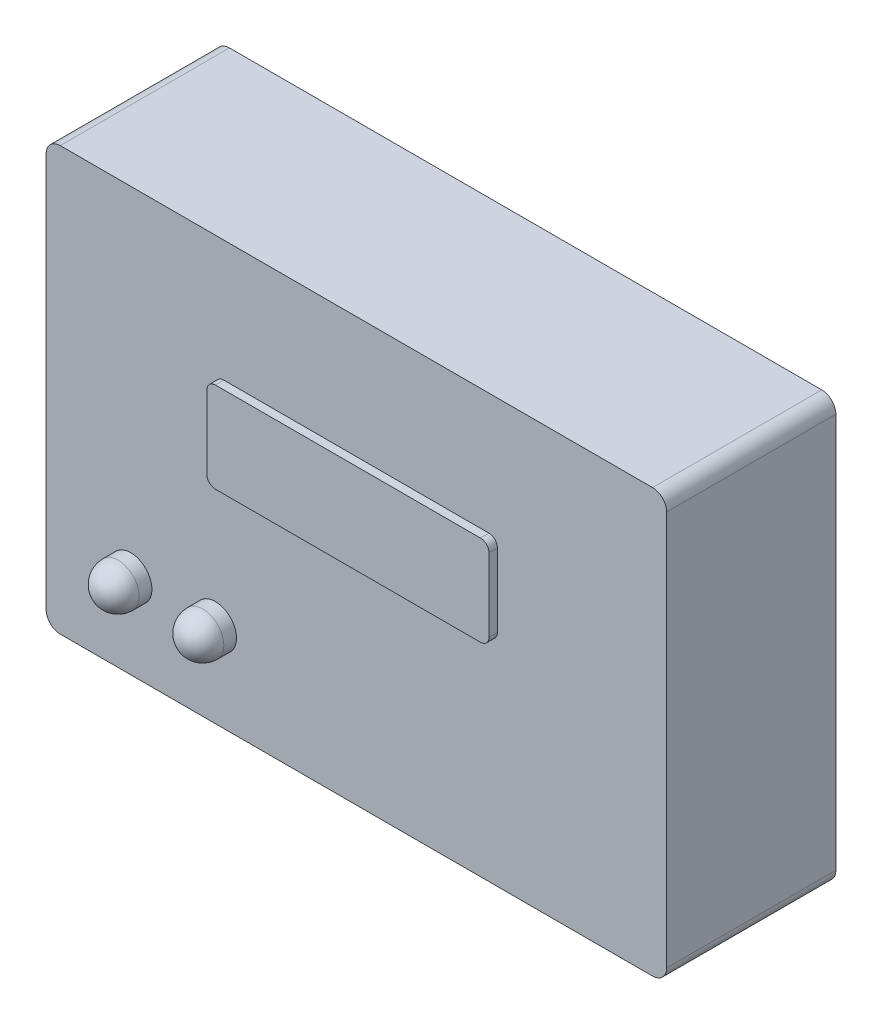
from build123d import *

# Parameters (mm, degrees)
BOSS_EXTRUDE1_DEPTH   = 30
CUT_EXTRUDE1_DEPTH    = 20
SKETCH3_R             = 2.5
BOSS_EXTRUDE2_DEPTH   = 3
SKETCH3_3_R           = 5
BOSS_EXTRUDE3_DEPTH   = 5
SKETCH3_4_R           = 7
SKETCH3_4_R_2         = 5
BOSS_EXTRUDE4_DEPTH   = 6
BOSS_EXTRUDE5_DEPTH   = 3
SKETCH5_R             = 7.5
BOSS_EXTRUDE6_DEPTH   = 12
BOSS_EXTRUDE6_2_DEPTH = 12
FILLET2_R             = 7.5
FILLET3_R             = 7.5


with BuildPart() as part:
    # Sketch1 → Boss-Extrude1 (new, symmetric)
    with BuildSketch(Plane.XY):
        with BuildLine():
            Line((-105, -75), (105, -75))
            ThreePointArc((105, -75), (108.535533906, -73.535533906), (110, -70))
            Line((110, -70), (110, 70))
            ThreePointArc((110, 70), (108.535533906, 73.535533906), (105, 75))
            Line((105, 75), (-105, 75))
            ThreePointArc((-105, 75), (-108.535533906, 73.535533906), (-110, 70))
            Line((-110, 70), (-110, -70))
            ThreePointArc((-110, -70), (-108.535533906, -73.535533906), (-105, -75))
        make_face()
    extrude(amount=BOSS_EXTRUDE1_DEPTH, both=True)

    # Sketch2 → Cut-Extrude1 (cut)
    with BuildSketch(Plane(origin=(0, 0, -30), x_dir=(-1, 0, 0), z_dir=(0, 0, -1))):
        with BuildLine():
            Line((-105, -73), (105, -73))
            ThreePointArc((105, -73), (107.121320344, -72.121320344), (108, -70))
            Line((108, -70), (108, 70))
            ThreePointArc((108, 70), (107.121320344, 72.121320344), (105, 73))
            Line((105, 73), (-105, 73))
            ThreePointArc((-105, 73), (-107.121320344, 72.121320344), (-108, 70))
            Line((-108, 70), (-108, -70))
            ThreePointArc((-108, -70), (-107.121320344, -72.121320344), (-105, -73))
        make_face()
    extrude(amount=-CUT_EXTRUDE1_DEPTH, mode=Mode.SUBTRACT)


with BuildPart() as body_2:
    # Sketch3 → Boss-Extrude2 (new body)
    with BuildSketch(Plane(origin=(0, 0, -10), x_dir=(-1, 0, 0), z_dir=(0, 0, -1))):
        with Locations((25, 0)):
            Circle(SKETCH3_R)
    extrude(amount=BOSS_EXTRUDE2_DEPTH)


with BuildPart() as body_3:
    # Sketch3<3> → Boss-Extrude3 (new body)
    with BuildSketch(Plane(origin=(0, 0, -10), x_dir=(-1, 0, 0), z_dir=(0, 0, -1))):
        with Locations((-25, 0)):
            Circle(SKETCH3_3_R)
    extrude(amount=BOSS_EXTRUDE3_DEPTH)


with BuildPart() as body_4:
    # Sketch3<4> → Boss-Extrude4 (new body)
    with BuildSketch(Plane(origin=(0, 0, -10), x_dir=(-1, 0, 0), z_dir=(0, 0, -1))):
        with Locations((-25, 0)):
            Circle(SKETCH3_4_R)
        with Locations((-25, 0)):
            Circle(SKETCH3_4_R_2, mode=Mode.SUBTRACT)
    extrude(amount=BOSS_EXTRUDE4_DEPTH)


with BuildPart() as body_5:
    # Sketch4 → Boss-Extrude5 (new body)
    with BuildSketch(Plane.XY.offset(30)):
        with BuildLine():
            Line((-47, 32), (47, 32))
            ThreePointArc((47, 32), (49.121320344, 31.121320344), (50, 29))
            Line((50, 29), (50, 3))
            ThreePointArc((50, 3), (49.121320344, 0.878679656), (47, 0))
            Line((47, 0), (-47, 0))
            ThreePointArc((-47, 0), (-49.121320344, 0.878679656), (-50, 3))
            Line((-50, 3), (-50, 29))
            ThreePointArc((-50, 29), (-49.121320344, 31.121320344), (-47, 32))
        make_face()
    extrude(amount=BOSS_EXTRUDE5_DEPTH)


with BuildPart() as body_6:
    # Sketch5 → Boss-Extrude6 (new body)
    with BuildSketch(Plane.XY.offset(30)):
        with Locations((-80, -45)):
            Circle(SKETCH5_R)
    extrude(amount=BOSS_EXTRUDE6_DEPTH)

    # Fillet2
    fillet2_edges = [body_6.edges().sort_by_distance(p)[0] for p in [
        (-87.5, -45, 42),
    ]]
    fillet(fillet2_edges, radius=FILLET2_R)


with BuildPart() as body_7:
    # Sketch5 → Boss-Extrude6 2 (new body)
    with BuildSketch(Plane.XY.offset(30)):
        with Locations((-50, -45)):
            Circle(SKETCH5_R)
    extrude(amount=BOSS_EXTRUDE6_2_DEPTH)

    # Fillet3
    fillet3_edges = [body_7.edges().sort_by_distance(p)[0] for p in [
        (-57.5, -45, 42),
    ]]
    fillet(fillet3_edges, radius=FILLET3_R)


solid = Compound([part.part, body_2.part, body_3.part, body_4.part, body_5.part, body_6.part, body_7.part])
